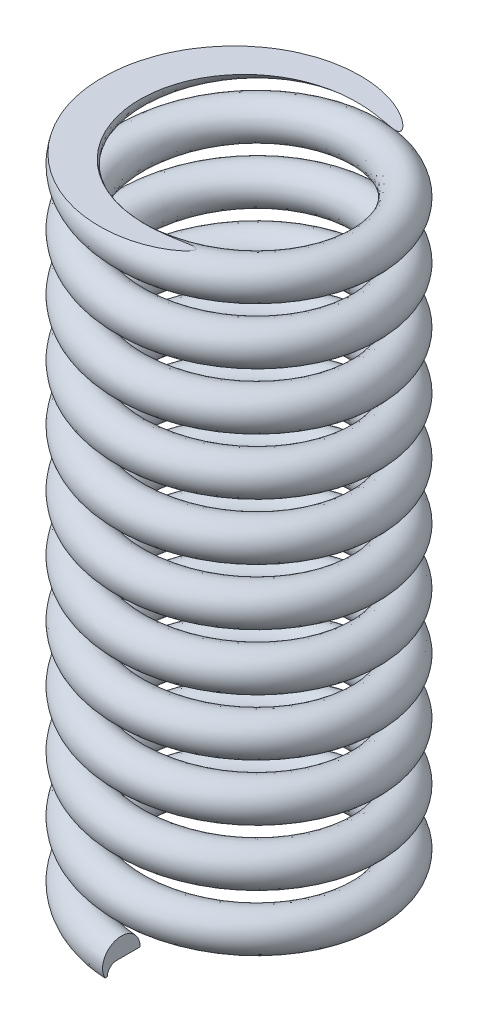
from build123d import *

# Parameters (mm, degrees)
SWEEP_1_PITCH  = 6
SWEEP_1_HEIGHT = 70
SWEEP_1_RADIUS = 12.5
SKETCH_2_R     = 2
SKETCH_4_W     = 24.98699262
SKETCH_4_H     = 12.444883926


with BuildPart() as part:
    # По траектории1: sweep along a helix
    with BuildLine() as sweep_1_path:
        Helix(SWEEP_1_PITCH, SWEEP_1_HEIGHT, SWEEP_1_RADIUS, center=(0, 0, 0), direction=(0, 1, 0), lefthand=True)
    # Эскиз2 → По траектории1 (sweep)
    with BuildSketch(Plane(origin=(0, 0, 0), x_dir=(0, 0, -1), z_dir=(1, 0, 0))):
        with Locations((-12.5, 0)):
            Circle(SKETCH_2_R)
    sweep(path=sweep_1_path.line, is_frenet=True)

    # Эскиз4 → Вырез-Повернуть1 (revolve, cut)
    with BuildSketch(Plane(origin=(0, 0, 0), x_dir=(0, 0, -1), z_dir=(1, 0, 0))):
        with BuildLine():
            Line((0, 0), (-13, 0))
            ThreePointArc((-13, 0), (-13.707106781, -0.292893219), (-14, -1))
            Line((-14, -1), (-16.530369177, -1))
            Line((-16.530369177, -1), (-16.530369177, -3.823438274))
            Line((-16.530369177, -3.823438274), (0, -3.823438274))
            Line((0, -3.823438274), (0, 0))
        make_face()
        with Locations((12.49349631, 73.722441963)):
            Rectangle(SKETCH_4_W, SKETCH_4_H)
    revolve(axis=Axis((0, 79.944883926, 0), (0, -1, 0)), mode=Mode.SUBTRACT)


solid = part.part
